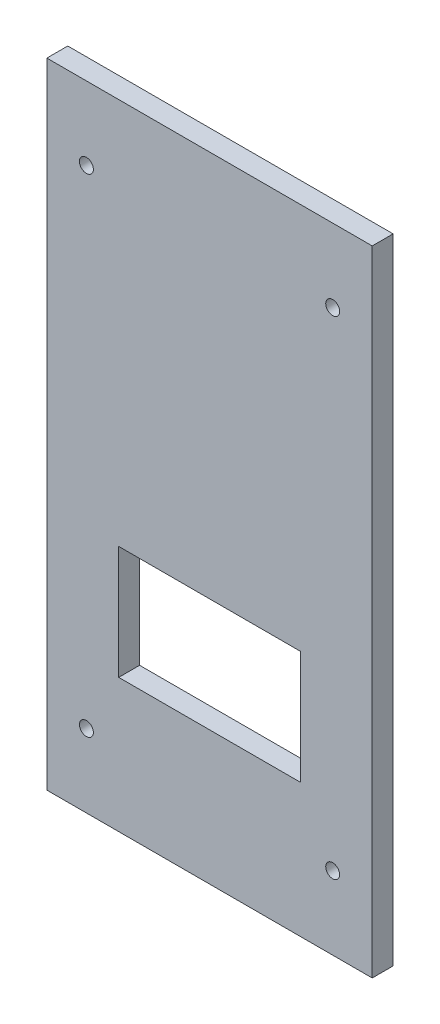
from build123d import *

# Parameters (mm, degrees)
SKETCH2_W           = 46.7
SKETCH2_H           = 91
SKETCH2_R           = 1
SKETCH2_W_2         = 26.073503968
SKETCH2_H_2         = 16.277986644
BOSS_EXTRUDE1_DEPTH = 3


with BuildPart() as part:
    # Sketch2 → Boss-Extrude1 (new body)
    with BuildSketch(Plane.XY):
        Rectangle(SKETCH2_W, SKETCH2_H)
        with Locations((17.675, 35)):
            Circle(SKETCH2_R, mode=Mode.SUBTRACT)
        with Locations(Location((-17.675, 35, 0), (0, 0, 180))):
            Circle(SKETCH2_R, mode=Mode.SUBTRACT)
        with Locations((-17.675, -35)):
            Circle(SKETCH2_R, mode=Mode.SUBTRACT)
        with Locations(Location((17.675, -35, 0), (0, 0, 180))):
            Circle(SKETCH2_R, mode=Mode.SUBTRACT)
        with Locations((0, -18.185085705)):
            Rectangle(SKETCH2_W_2, SKETCH2_H_2, mode=Mode.SUBTRACT)
    extrude(amount=BOSS_EXTRUDE1_DEPTH)


solid = part.part
